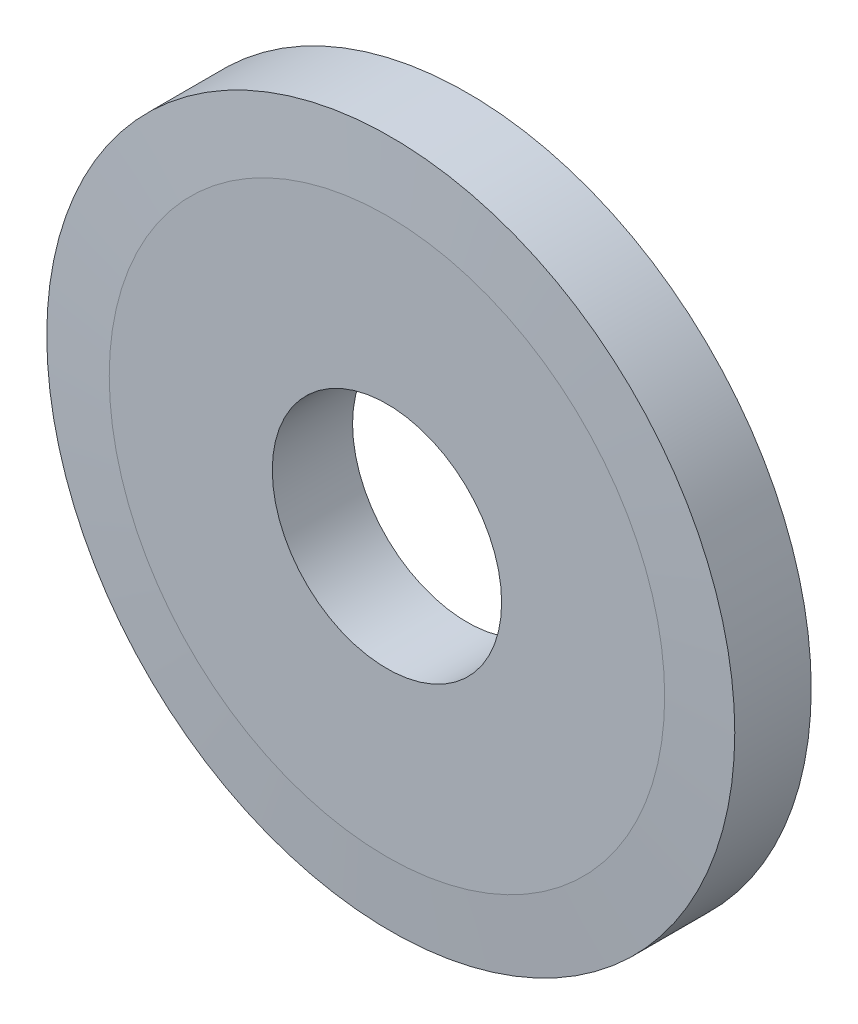
from build123d import *

# Parameters (mm, degrees)
SKETCH2_R           = 9
SKETCH2_R_2         = 3
BOSS_EXTRUDE1_DEPTH = 2
SKETCH4_R           = 9
BOSS_EXTRUDE2_DEPTH = 0.1
BOSS_EXTRUDE2_TAPER = 86.7
SKETCH5_R           = 3
CUT_EXTRUDE1_DEPTH  = 0.1


with BuildPart() as part:
    # Sketch2 → Boss-Extrude1 (new body)
    with BuildSketch(Plane.XY):
        Circle(SKETCH2_R)
        Circle(SKETCH2_R_2, mode=Mode.SUBTRACT)
    extrude(amount=BOSS_EXTRUDE1_DEPTH)

    # Sketch4 → Boss-Extrude2 (add)
    with BuildSketch(Plane.XY.offset(2)):
        Circle(SKETCH4_R)
    extrude(amount=BOSS_EXTRUDE2_DEPTH, taper=BOSS_EXTRUDE2_TAPER)

    # Sketch5 → Cut-Extrude1 (cut)
    with BuildSketch(Plane(origin=(0, 0, 2), x_dir=(-1, 0, 0), z_dir=(0, 0, -1))):
        Circle(SKETCH5_R)
    extrude(amount=-CUT_EXTRUDE1_DEPTH, mode=Mode.SUBTRACT)


solid = part.part
